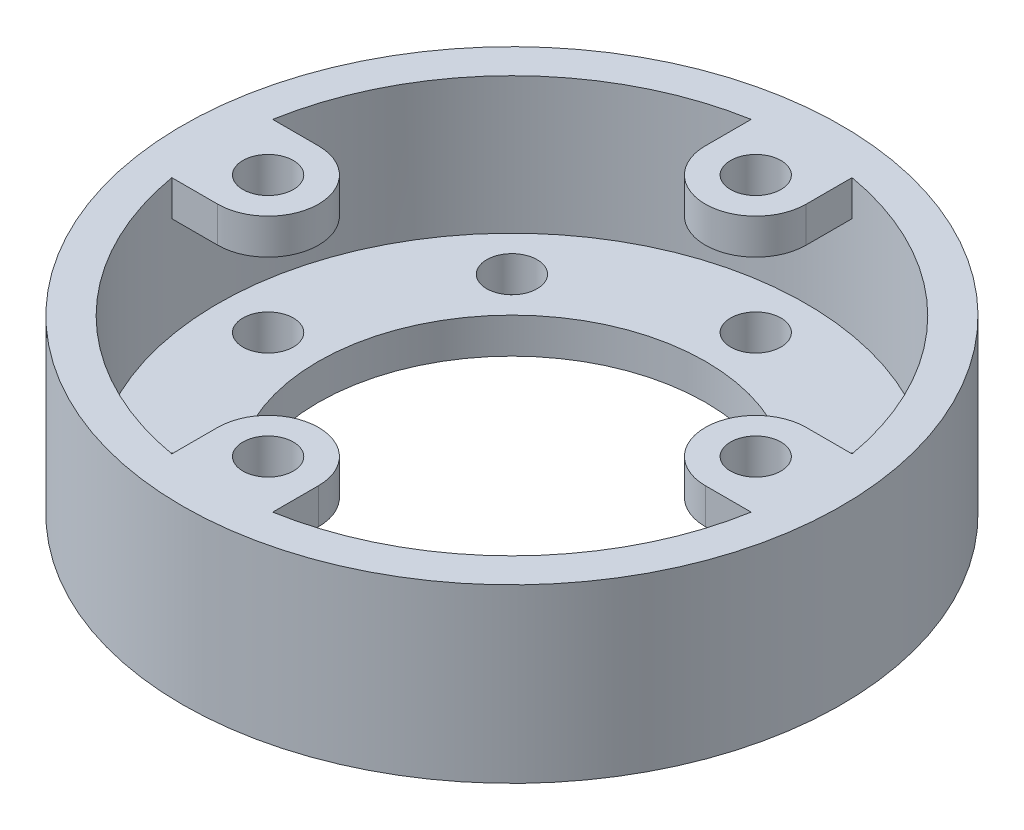
from build123d import *

# Parameters (mm, degrees)
SKETCH1_R           = 73.025
SKETCH1_R_2         = 42.926
BOSS_EXTRUDE1_DEPTH = 7.874
SKETCH2_R           = 73.025
SKETCH2_R_2         = 65.151
BOSS_EXTRUDE2_DEPTH = 30.226
BOSS_EXTRUDE3_START = -7.874
SKETCH3_R           = 5.588
BOSS_EXTRUDE3_DEPTH = 7.874
SKETCH4_R           = 5.588
CUT_EXTRUDE1_DEPTH  = 108.605354541


with BuildPart() as part:
    # Sketch1 → Boss-Extrude1 (new body)
    with BuildSketch(Plane(origin=(0, 0, 0), x_dir=(1, 0, 0), z_dir=(0, 1, 0))):
        with Locations(Location((0, 0, 0), (0, 0, 270))):
            Circle(SKETCH1_R)
        with Locations(Location((0, 0, 0), (0, 0, 270))):
            Circle(SKETCH1_R_2, mode=Mode.SUBTRACT)
    extrude(amount=BOSS_EXTRUDE1_DEPTH)

    # Sketch2 → Boss-Extrude2 (add)
    with BuildSketch(Plane(origin=(0, 7.874, 0), x_dir=(1, 0, 0), z_dir=(0, 1, 0))):
        with Locations(Location((0, 0, 0), (0, 0, 270))):
            Circle(SKETCH2_R)
        with Locations(Location((0, 0, 0), (0, 0, 270))):
            Circle(SKETCH2_R_2, mode=Mode.SUBTRACT)
    extrude(amount=BOSS_EXTRUDE2_DEPTH)

    # Sketch3 → Boss-Extrude3 (add)
    # profile 1 of 4: a face of its own
    with BuildSketch(Plane(origin=(0, 38.1, 0), x_dir=(1, 0, 0), z_dir=(0, 1, 0)).offset(BOSS_EXTRUDE3_START)):
        with BuildLine():
            Line((-54.025277323, 11.176), (-64.185277323, 11.176))
            ThreePointArc((-64.185277323, 11.176), (-65.151, 0), (-64.185277323, -11.176))
            Line((-64.185277323, -11.176), (-54.025277323, -11.176))
            ThreePointArc((-54.025277323, -11.176), (-42.849277323, 0), (-54.025277323, 11.176))
        make_face()
        with Locations(Location((-54.025277323, 0, 0), (0, 0, 270))):
            Circle(SKETCH3_R, mode=Mode.SUBTRACT)
    # profile 2 of 4: a face of its own
    with BuildSketch(Plane(origin=(0, 38.1, 0), x_dir=(1, 0, 0), z_dir=(0, 1, 0)).offset(BOSS_EXTRUDE3_START)):
        with BuildLine():
            ThreePointArc((11.176, 64.185277323), (0, 65.151), (-11.176, 64.185277323))
            Line((-11.176, 64.185277323), (-11.176, 54.025277323))
            ThreePointArc((-11.176, 54.025277323), (0, 42.849277323), (11.176, 54.025277323))
            Line((11.176, 54.025277323), (11.176, 64.185277323))
        make_face()
        with Locations(Location((0, 54.025277323, 0), (0, 0, 270))):
            Circle(SKETCH3_R, mode=Mode.SUBTRACT)
    # profile 3 of 4: a face of its own
    with BuildSketch(Plane(origin=(0, 38.1, 0), x_dir=(1, 0, 0), z_dir=(0, 1, 0)).offset(BOSS_EXTRUDE3_START)):
        with BuildLine():
            ThreePointArc((65.151, 0), (64.909120329, 5.608823323), (64.185277323, 11.176))
            Line((64.185277323, 11.176), (54.025277323, 11.176))
            ThreePointArc((54.025277323, 11.176), (42.849277323, 0), (54.025277323, -11.176))
            Line((54.025277323, -11.176), (64.185277323, -11.176))
            ThreePointArc((64.185277323, -11.176), (64.909120329, -5.608823323), (65.151, 0))
        make_face()
        with Locations(Location((54.025277323, 0, 0), (0, 0, 270))):
            Circle(SKETCH3_R, mode=Mode.SUBTRACT)
    # profile 4 of 4: a face of its own
    with BuildSketch(Plane(origin=(0, 38.1, 0), x_dir=(1, 0, 0), z_dir=(0, 1, 0)).offset(BOSS_EXTRUDE3_START)):
        with BuildLine():
            Line((-11.176, -54.025277323), (-11.176, -64.185277323))
            ThreePointArc((-11.176, -64.185277323), (0, -65.151), (11.176, -64.185277323))
            Line((11.176, -64.185277323), (11.176, -54.025277323))
            ThreePointArc((11.176, -54.025277323), (0, -42.849277323), (-11.176, -54.025277323))
        make_face()
        with Locations(Location((0, -54.025277323, 0), (0, 0, 270))):
            Circle(SKETCH3_R, mode=Mode.SUBTRACT)
    extrude(amount=BOSS_EXTRUDE3_DEPTH)

    # Sketch4 → Cut-Extrude1 (cut, through all)
    with BuildSketch(Plane(origin=(0, 7.874, 0), x_dir=(1, 0, 0), z_dir=(0, 1, 0))):
        with Locations(Location((-54.025277323, 0, 0), (0, 0, 270))):
            Circle(SKETCH4_R)
        with Locations(Location((-38.20163995, 38.20163995, 0), (0, 0, 270))):
            Circle(SKETCH4_R)
        with Locations(Location((0, 54.025277323, 0), (0, 0, 270))):
            Circle(SKETCH4_R)
        with Locations(Location((38.20163995, 38.20163995, 0), (0, 0, 270))):
            Circle(SKETCH4_R)
        with Locations(Location((54.025277323, 0, 0), (0, 0, 270))):
            Circle(SKETCH4_R)
        with Locations(Location((38.20163995, -38.20163995, 0), (0, 0, 270))):
            Circle(SKETCH4_R)
        with Locations(Location((0, -54.025277323, 0), (0, 0, 270))):
            Circle(SKETCH4_R)
        with Locations(Location((-38.20163995, -38.20163995, 0), (0, 0, 270))):
            Circle(SKETCH4_R)
    extrude(amount=-CUT_EXTRUDE1_DEPTH, mode=Mode.SUBTRACT)


solid = part.part
